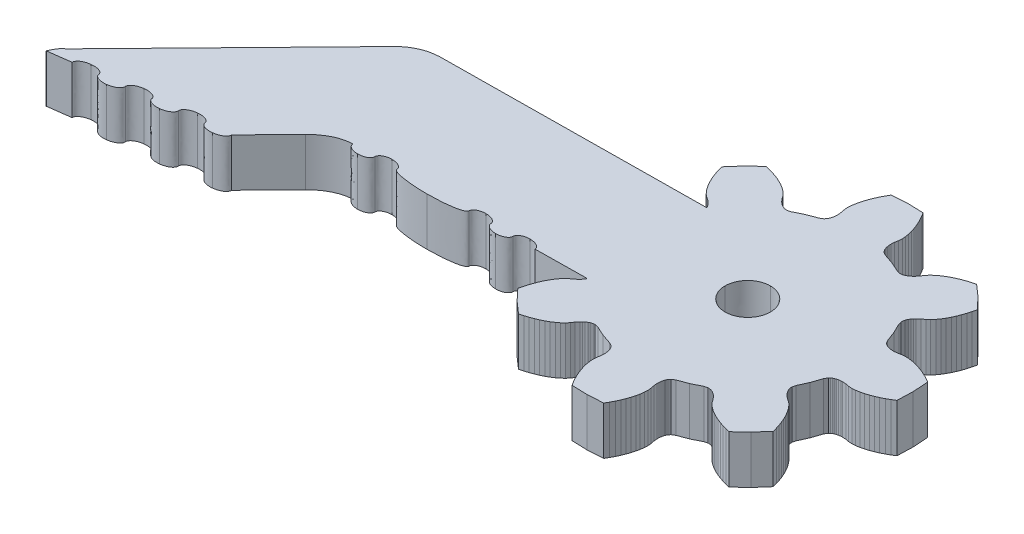
from build123d import *

# Parameters (mm, degrees)
BOSS_EXTRUDE1_DEPTH = 3.175


with BuildPart() as part:
    # Sketch1 → Boss-Extrude1 (new body)
    with BuildSketch(Plane(origin=(0, 0, 0), x_dir=(1, 0, 0), z_dir=(0, 1, 0))):
        with BuildLine():
            Line((81.057760584, 158.271437226), (81.024260584, 158.305437226))
            Line((81.024260584, 158.305437226), (77.647660584, 158.261337226))
            add(Edge.make_bspline(
                [(77.647660584, 158.261337226), (77.644460584, 158.489437226), (77.315160584, 158.674337226), (76.912260584, 158.674337226)],
                knots=[0.005763689, 0.005763689, 0.005763689, 0.005763689, 0.008645533, 0.008645533, 0.008645533, 0.008645533], degree=3))
            add(Edge.make_bspline(
                [(76.912260584, 158.674337226), (76.509260584, 158.674337226), (76.185260584, 158.489437226), (76.188460584, 158.261337226)],
                knots=[0.008645533, 0.008645533, 0.008645533, 0.008645533, 0.011527378, 0.011527378, 0.011527378, 0.011527378], degree=3))
            add(Edge.make_bspline(
                [(76.188460584, 158.261337226), (76.191560584, 158.033237226), (75.867560584, 157.848337226), (75.464560584, 157.848337226)],
                knots=[0.011527378, 0.011527378, 0.011527378, 0.011527378, 0.014409222, 0.014409222, 0.014409222, 0.014409222], degree=3))
            add(Edge.make_bspline(
                [(75.464560584, 157.848337226), (75.061660584, 157.848337226), (74.732360584, 158.033237226), (74.729160584, 158.261337226)],
                knots=[0.014409222, 0.014409222, 0.014409222, 0.014409222, 0.017291066, 0.017291066, 0.017291066, 0.017291066], degree=3))
            add(Edge.make_bspline(
                [(74.729160584, 158.261337226), (74.725860584, 158.489437226), (74.396660584, 158.674337226), (73.993660584, 158.674337226)],
                knots=[0.017291066, 0.017291066, 0.017291066, 0.017291066, 0.020172911, 0.020172911, 0.020172911, 0.020172911], degree=3))
            add(Edge.make_bspline(
                [(73.993660584, 158.674337226), (73.590760584, 158.674337226), (73.266660584, 158.489437226), (73.269660584, 158.261337226)],
                knots=[0.020172911, 0.020172911, 0.020172911, 0.020172911, 0.023054755, 0.023054755, 0.023054755, 0.023054755], degree=3))
            add(Edge.make_bspline(
                [(73.269660584, 158.261337226), (73.279960584, 158.033137226), (72.223060584, 157.848237226), (70.908960584, 157.848237226)],
                knots=[0.023054755, 0.023054755, 0.023054755, 0.023054755, 0.025936599, 0.025936599, 0.025936599, 0.025936599], degree=3))
            add(Edge.make_bspline(
                [(70.908960584, 157.848237226), (69.594860584, 157.848237226), (68.521060584, 158.033137226), (68.510660584, 158.261337226)],
                knots=[0.025936599, 0.025936599, 0.025936599, 0.025936599, 0.028818444, 0.028818444, 0.028818444, 0.028818444], degree=3))
            add(Edge.make_bspline(
                [(68.510660584, 158.261337226), (68.507360584, 158.489337226), (68.178160584, 158.674237226), (67.775160584, 158.674237226)],
                knots=[0.028818444, 0.028818444, 0.028818444, 0.028818444, 0.031700288, 0.031700288, 0.031700288, 0.031700288], degree=3))
            add(Edge.make_bspline(
                [(67.775160584, 158.674237226), (67.372260584, 158.674237226), (67.048160584, 158.489337226), (67.051360584, 158.261237226)],
                knots=[0.031700288, 0.031700288, 0.031700288, 0.031700288, 0.034582133, 0.034582133, 0.034582133, 0.034582133], degree=3))
            add(Edge.make_bspline(
                [(67.051360584, 158.261237226), (67.054560584, 158.033137226), (66.730460584, 157.848237226), (66.327560584, 157.848237226)],
                knots=[0.034582133, 0.034582133, 0.034582133, 0.034582133, 0.037463977, 0.037463977, 0.037463977, 0.037463977], degree=3))
            add(Edge.make_bspline(
                [(66.327560584, 157.848237226), (65.924560584, 157.848237226), (65.595360584, 158.033137226), (65.592160584, 158.261237226)],
                knots=[0.037463977, 0.037463977, 0.037463977, 0.037463977, 0.040345821, 0.040345821, 0.040345821, 0.040345821], degree=3))
            add(Edge.make_bspline(
                [(65.592160584, 158.261237226), (64.796560584, 158.251337226), (64.037360584, 157.811837226), (63.481760584, 157.242337226)],
                knots=[0.040345821, 0.040345821, 0.040345821, 0.040345821, 0.043227666, 0.043227666, 0.043227666, 0.043227666], degree=3))
            Line((63.481760584, 157.242337226), (61.063960584, 154.763437226))
            add(Edge.make_bspline(
                [(61.063960584, 154.763437226), (61.087160584, 154.536437226), (60.753960584, 154.311137226), (60.319760584, 154.259937226)],
                knots=[0.04610951, 0.04610951, 0.04610951, 0.04610951, 0.048991354, 0.048991354, 0.048991354, 0.048991354], degree=3))
            add(Edge.make_bspline(
                [(60.319760584, 154.259937226), (59.885460584, 154.208837226), (59.514660584, 154.351437226), (59.491460584, 154.578337226)],
                knots=[0.048991354, 0.048991354, 0.048991354, 0.048991354, 0.051873199, 0.051873199, 0.051873199, 0.051873199], degree=3))
            add(Edge.make_bspline(
                [(59.491460584, 154.578337226), (59.468160584, 154.805337226), (59.097360584, 154.947837226), (58.663160584, 154.896737226)],
                knots=[0.051873199, 0.051873199, 0.051873199, 0.051873199, 0.054755043, 0.054755043, 0.054755043, 0.054755043], degree=3))
            add(Edge.make_bspline(
                [(58.663160584, 154.896737226), (58.228860584, 154.845637226), (57.895660584, 154.620237226), (57.918860584, 154.393337226)],
                knots=[0.054755043, 0.054755043, 0.054755043, 0.054755043, 0.057636888, 0.057636888, 0.057636888, 0.057636888], degree=3))
            add(Edge.make_bspline(
                [(57.918860584, 154.393337226), (57.942060584, 154.166437226), (57.608860584, 153.941037226), (57.174560584, 153.889937226)],
                knots=[0.057636888, 0.057636888, 0.057636888, 0.057636888, 0.060518732, 0.060518732, 0.060518732, 0.060518732], degree=3))
            add(Edge.make_bspline(
                [(57.174560584, 153.889937226), (56.740360584, 153.838837226), (56.369460584, 153.981337226), (56.346260584, 154.208337226)],
                knots=[0.060518732, 0.060518732, 0.060518732, 0.060518732, 0.063400576, 0.063400576, 0.063400576, 0.063400576], degree=3))
            add(Edge.make_bspline(
                [(56.346260584, 154.208337226), (56.323060584, 154.435237226), (55.952160584, 154.577737226), (55.517960584, 154.526637226)],
                knots=[0.063400576, 0.063400576, 0.063400576, 0.063400576, 0.066282421, 0.066282421, 0.066282421, 0.066282421], degree=3))
            add(Edge.make_bspline(
                [(55.517960584, 154.526637226), (55.083660584, 154.475537226), (54.750460584, 154.250137226), (54.773760584, 154.023237226)],
                knots=[0.066282421, 0.066282421, 0.066282421, 0.066282421, 0.069164265, 0.069164265, 0.069164265, 0.069164265], degree=3))
            add(Edge.make_bspline(
                [(54.773760584, 154.023237226), (54.796860584, 153.796337226), (54.463660584, 153.570937226), (54.029360584, 153.519837226)],
                knots=[0.069164265, 0.069164265, 0.069164265, 0.069164265, 0.07204611, 0.07204611, 0.07204611, 0.07204611], degree=3))
            add(Edge.make_bspline(
                [(54.029360584, 153.519837226), (53.595160584, 153.468737226), (53.224360584, 153.611237226), (53.201160584, 153.838237226)],
                knots=[0.07204611, 0.07204611, 0.07204611, 0.07204611, 0.074927954, 0.074927954, 0.074927954, 0.074927954], degree=3))
            add(Edge.make_bspline(
                [(53.201160584, 153.838237226), (53.177860584, 154.065137226), (52.807060584, 154.207737226), (52.372760584, 154.156637226)],
                knots=[0.074927954, 0.074927954, 0.074927954, 0.074927954, 0.077809798, 0.077809798, 0.077809798, 0.077809798], degree=3))
            add(Edge.make_bspline(
                [(52.372760584, 154.156637226), (51.938560584, 154.105437226), (51.605360584, 153.880137226), (51.628560584, 153.653137226)],
                knots=[0.077809798, 0.077809798, 0.077809798, 0.077809798, 0.080691643, 0.080691643, 0.080691643, 0.080691643], degree=3))
            Line((51.628560584, 153.653137226), (50.124060584, 153.450637226))
            Line((50.124060584, 153.450637226), (50.127260584, 153.424837226))
            add(Edge.make_bspline(
                [(50.127260584, 153.424837226), (50.060160584, 153.424037226), (50.344260584, 153.959637226), (50.576860584, 154.198137226)],
                knots=[0.086455331, 0.086455331, 0.086455331, 0.086455331, 0.089337176, 0.089337176, 0.089337176, 0.089337176], degree=3))
            Line((50.576860584, 154.198137226), (50.620060584, 154.182837226))
            Line((50.620060584, 154.182837226), (61.382160584, 165.216737226))
            Line((61.382160584, 165.216737226), (61.385660584, 165.218237226))
            add(Edge.make_bspline(
                [(61.385660584, 165.218237226), (61.937960584, 165.791037226), (62.695160584, 166.120937226), (63.490660584, 166.135437226)],
                knots=[0.097982709, 0.097982709, 0.097982709, 0.097982709, 0.100864553, 0.100864553, 0.100864553, 0.100864553], degree=3))
            Line((63.490660584, 166.135437226), (80.976260584, 166.317737226))
            Line((80.976260584, 166.317737226), (80.961760584, 166.327237226))
            Line((80.961760584, 166.327237226), (80.930260584, 166.385737226))
            Line((80.930260584, 166.385737226), (80.860460584, 166.490737226))
            Line((80.860460584, 166.490737226), (80.783760584, 166.583937226))
            Line((80.783760584, 166.583937226), (80.701660584, 166.668037226))
            Line((80.701660584, 166.668037226), (80.524560584, 166.814937226))
            Line((80.524560584, 166.814937226), (80.333360584, 166.939237226))
            Line((80.333360584, 166.939237226), (80.155660584, 167.084937226))
            Line((80.155660584, 167.084937226), (79.996660584, 167.259937226))
            Line((79.996660584, 167.259937226), (79.850060584, 167.453237226))
            Line((79.850060584, 167.453237226), (79.714460584, 167.661737226))
            Line((79.714460584, 167.661737226), (79.589360584, 167.883737226))
            Line((79.589360584, 167.883737226), (79.474460584, 168.117937226))
            Line((79.474460584, 168.117937226), (79.369860584, 168.363537226))
            Line((79.369860584, 168.363537226), (79.275360584, 168.619737226))
            Line((79.275360584, 168.619737226), (79.191460584, 168.886037226))
            Line((79.191460584, 168.886037226), (79.118060584, 169.161737226))
            Line((79.118060584, 169.161737226), (79.800860584, 169.937437226))
            Line((79.800860584, 169.937437226), (80.554760584, 170.644337226))
            Line((80.554760584, 170.644337226), (80.832660584, 170.579637226))
            Line((80.832660584, 170.579637226), (81.101360584, 170.504037226))
            Line((81.101360584, 170.504037226), (81.360460584, 170.417737226))
            Line((81.360460584, 170.417737226), (81.609260584, 170.320837226))
            Line((81.609260584, 170.320837226), (81.846960584, 170.213337226))
            Line((81.846960584, 170.213337226), (82.072760584, 170.095237226))
            Line((82.072760584, 170.095237226), (82.285360584, 169.966337226))
            Line((82.285360584, 169.966337226), (82.483160584, 169.825937226))
            Line((82.483160584, 169.825937226), (82.663060584, 169.672437226))
            Line((82.663060584, 169.672437226), (82.814360584, 169.499437226))
            Line((82.814360584, 169.499437226), (82.944560584, 169.312237226))
            Line((82.944560584, 169.312237226), (83.096960584, 169.139837226))
            Line((83.096960584, 169.139837226), (83.183560584, 169.060337226))
            Line((83.183560584, 169.060337226), (83.279160584, 168.986637226))
            Line((83.279160584, 168.986637226), (83.386360584, 168.920137226))
            Line((83.386360584, 168.920137226), (83.445760584, 168.890537226))
            Line((83.445760584, 168.890537226), (83.510460584, 168.863937226))
            Line((83.510460584, 168.863937226), (83.582360584, 168.841537226))
            Line((83.582360584, 168.841537226), (83.665060584, 168.825337226))
            Line((83.665060584, 168.825337226), (83.767960584, 168.820537226))
            Line((83.767960584, 168.820537226), (83.987560584, 168.880437226))
            Line((83.987560584, 168.880437226), (84.621160584, 169.191437226))
            Line((84.621160584, 169.191437226), (85.281460584, 169.440337226))
            Line((85.281460584, 169.440337226), (85.475560584, 169.559537226))
            Line((85.475560584, 169.559537226), (85.542460584, 169.637837226))
            Line((85.542460584, 169.637837226), (85.587260584, 169.709137226))
            Line((85.587260584, 169.709137226), (85.620160584, 169.776837226))
            Line((85.620160584, 169.776837226), (85.645060584, 169.842237226))
            Line((85.645060584, 169.842237226), (85.664060584, 169.905837226))
            Line((85.664060584, 169.905837226), (85.689060584, 170.029537226))
            Line((85.689060584, 170.029537226), (85.700660584, 170.149637226))
            Line((85.700660584, 170.149637226), (85.702160584, 170.267137226))
            Line((85.702160584, 170.267137226), (85.680760584, 170.496237226))
            Line((85.680760584, 170.496237226), (85.633360584, 170.719337226))
            Line((85.633360584, 170.719337226), (85.610860584, 170.948037226))
            Line((85.610860584, 170.948037226), (85.622160584, 171.184237226))
            Line((85.622160584, 171.184237226), (85.655160584, 171.424537226))
            Line((85.655160584, 171.424537226), (85.706760584, 171.667837226))
            Line((85.706760584, 171.667837226), (85.775160584, 171.913237226))
            Line((85.775160584, 171.913237226), (85.859560584, 172.160137226))
            Line((85.859560584, 172.160137226), (85.959260584, 172.407837226))
            Line((85.959260584, 172.407837226), (86.073660584, 172.655737226))
            Line((86.073660584, 172.655737226), (86.202560584, 172.903437226))
            Line((86.202560584, 172.903437226), (86.345660584, 173.150237226))
            Line((86.345660584, 173.150237226), (87.376960584, 173.215937226))
            Line((87.376960584, 173.215937226), (88.409860584, 173.182637226))
            Line((88.409860584, 173.182637226), (88.560660584, 172.940437226))
            Line((88.560660584, 172.940437226), (88.697260584, 172.696937226))
            Line((88.697260584, 172.696937226), (88.819460584, 172.452737226))
            Line((88.819460584, 172.452737226), (88.926760584, 172.208237226))
            Line((88.926760584, 172.208237226), (89.018860584, 171.964237226))
            Line((89.018860584, 171.964237226), (89.095060584, 171.721037226))
            Line((89.095060584, 171.721037226), (89.154260584, 171.479537226))
            Line((89.154260584, 171.479537226), (89.194760584, 171.240337226))
            Line((89.194760584, 171.240337226), (89.213560584, 171.004637226))
            Line((89.213560584, 171.004637226), (89.198060584, 170.775337226))
            Line((89.198060584, 170.775337226), (89.157860584, 170.550837226))
            Line((89.157860584, 170.550837226), (89.143660584, 170.321237226))
            Line((89.143660584, 170.321237226), (89.148760584, 170.203837226))
            Line((89.148760584, 170.203837226), (89.164160584, 170.084137226))
            Line((89.164160584, 170.084137226), (89.192960584, 169.961337226))
            Line((89.192960584, 169.961337226), (89.213960584, 169.898237226))
            Line((89.213960584, 169.898237226), (89.240960584, 169.833737226))
            Line((89.240960584, 169.833737226), (89.275960584, 169.767137226))
            Line((89.275960584, 169.767137226), (89.323060584, 169.697137226))
            Line((89.323060584, 169.697137226), (89.392360584, 169.621037226))
            Line((89.392360584, 169.621037226), (89.589960584, 169.508037226))
            Line((89.589960584, 169.508037226), (90.257860584, 169.280037226))
            Line((90.257860584, 169.280037226), (90.900860584, 168.989037226))
            Line((90.900860584, 168.989037226), (91.122260584, 168.936137226))
            Line((91.122260584, 168.936137226), (91.224960584, 168.944137226))
            Line((91.224960584, 168.944137226), (91.307160584, 168.962937226))
            Line((91.307160584, 168.962937226), (91.378260584, 168.987537226))
            Line((91.378260584, 168.987537226), (91.442160584, 169.016137226))
            Line((91.442160584, 169.016137226), (91.500560584, 169.047637226))
            Line((91.500560584, 169.047637226), (91.605660584, 169.117437226))
            Line((91.605660584, 169.117437226), (91.698860584, 169.194137226))
            Line((91.698860584, 169.194137226), (91.782860584, 169.276237226))
            Line((91.782860584, 169.276237226), (91.929760584, 169.453337226))
            Line((91.929760584, 169.453337226), (92.054060584, 169.644537226))
            Line((92.054060584, 169.644537226), (92.199860584, 169.822337226))
            Line((92.199860584, 169.822337226), (92.374860584, 169.981237226))
            Line((92.374860584, 169.981237226), (92.568160584, 170.127837226))
            Line((92.568160584, 170.127837226), (92.776660584, 170.263437226))
            Line((92.776660584, 170.263437226), (92.998560584, 170.388537226))
            Line((92.998560584, 170.388537226), (93.232760584, 170.503437226))
            Line((93.232760584, 170.503437226), (93.478360584, 170.608137226))
            Line((93.478360584, 170.608137226), (93.734660584, 170.702537226))
            Line((93.734660584, 170.702537226), (94.000960584, 170.786437226))
            Line((94.000960584, 170.786437226), (94.276560584, 170.859837226))
            Line((94.276560584, 170.859837226), (95.052360584, 170.177037226))
            Line((95.052360584, 170.177037226), (95.759160584, 169.423137226))
            Line((95.759160584, 169.423137226), (95.694460584, 169.145337226))
            Line((95.694460584, 169.145337226), (95.618860584, 168.876537226))
            Line((95.618860584, 168.876537226), (95.532660584, 168.617437226))
            Line((95.532660584, 168.617437226), (95.435660584, 168.368637226))
            Line((95.435660584, 168.368637226), (95.328260584, 168.130937226))
            Line((95.328260584, 168.130937226), (95.210160584, 167.905137226))
            Line((95.210160584, 167.905137226), (95.081160584, 167.692537226))
            Line((95.081160584, 167.692537226), (94.940760584, 167.494737226))
            Line((94.940760584, 167.494737226), (94.787360584, 167.314837226))
            Line((94.787360584, 167.314837226), (94.614360584, 167.163537226))
            Line((94.614360584, 167.163537226), (94.427060584, 167.033337226))
            Line((94.427060584, 167.033337226), (94.254660584, 166.880937226))
            Line((94.254660584, 166.880937226), (94.175260584, 166.794337226))
            Line((94.175260584, 166.794337226), (94.101560584, 166.698837226))
            Line((94.101560584, 166.698837226), (94.035060584, 166.591537226))
            Line((94.035060584, 166.591537226), (94.005360584, 166.532137226))
            Line((94.005360584, 166.532137226), (93.978760584, 166.467437226))
            Line((93.978760584, 166.467437226), (93.956460584, 166.395537226))
            Line((93.956460584, 166.395537226), (93.940260584, 166.312837226))
            Line((93.940260584, 166.312837226), (93.935460584, 166.210037226))
            Line((93.935460584, 166.210037226), (93.995360584, 165.990337226))
            Line((93.995360584, 165.990337226), (94.306360584, 165.356837226))
            Line((94.306360584, 165.356837226), (94.555260584, 164.696437226))
            Line((94.555260584, 164.696437226), (94.674360584, 164.502437226))
            Line((94.674360584, 164.502437226), (94.752660584, 164.435437226))
            Line((94.752660584, 164.435437226), (94.823960584, 164.390637226))
            Line((94.823960584, 164.390637226), (94.891760584, 164.357837226))
            Line((94.891760584, 164.357837226), (94.957060584, 164.332837226))
            Line((94.957060584, 164.332837226), (95.020760584, 164.313837226))
            Line((95.020760584, 164.313837226), (95.144360584, 164.288837226))
            Line((95.144360584, 164.288837226), (95.264460584, 164.277237226))
            Line((95.264460584, 164.277237226), (95.381960584, 164.275837226))
            Line((95.381960584, 164.275837226), (95.611160584, 164.297237226))
            Line((95.611160584, 164.297237226), (95.834160584, 164.344537226))
            Line((95.834160584, 164.344537226), (96.062960584, 164.367137226))
            Line((96.062960584, 164.367137226), (96.299160584, 164.355737226))
            Line((96.299160584, 164.355737226), (96.539460584, 164.322737226))
            Line((96.539460584, 164.322737226), (96.782760584, 164.271237226))
            Line((96.782760584, 164.271237226), (97.028160584, 164.202737226))
            Line((97.028160584, 164.202737226), (97.274960584, 164.118337226))
            Line((97.274960584, 164.118337226), (97.522660584, 164.018637226))
            Line((97.522660584, 164.018637226), (97.770660584, 163.904237226))
            Line((97.770660584, 163.904237226), (98.018260584, 163.775337226))
            Line((98.018260584, 163.775337226), (98.265160584, 163.632337226))
            Line((98.265160584, 163.632337226), (98.330760584, 162.600937226))
            Line((98.330760584, 162.600937226), (98.297560584, 161.568037226))
            Line((98.297560584, 161.568037226), (98.055360584, 161.417337226))
            Line((98.055360584, 161.417337226), (97.811860584, 161.280637226))
            Line((97.811860584, 161.280637226), (97.567660584, 161.158537226))
            Line((97.567660584, 161.158537226), (97.323160584, 161.051137226))
            Line((97.323160584, 161.051137226), (97.079060584, 160.959037226))
            Line((97.079060584, 160.959037226), (96.835960584, 160.882937226))
            Line((96.835960584, 160.882937226), (96.594360584, 160.823737226))
            Line((96.594360584, 160.823737226), (96.355260584, 160.783137226))
            Line((96.355260584, 160.783137226), (96.119560584, 160.764437226))
            Line((96.119560584, 160.764437226), (95.890260584, 160.779837226))
            Line((95.890260584, 160.779837226), (95.665760584, 160.820137226))
            Line((95.665760584, 160.820137226), (95.436060584, 160.834237226))
            Line((95.436060584, 160.834237226), (95.318660584, 160.829137226))
            Line((95.318660584, 160.829137226), (95.198960584, 160.813737226))
            Line((95.198960584, 160.813737226), (95.076160584, 160.784937226))
            Line((95.076160584, 160.784937226), (95.013160584, 160.763937226))
            Line((95.013160584, 160.763937226), (94.948660584, 160.736937226))
            Line((94.948660584, 160.736937226), (94.881960584, 160.701937226))
            Line((94.881960584, 160.701937226), (94.812060584, 160.654937226))
            Line((94.812060584, 160.654937226), (94.735960584, 160.585537226))
            Line((94.735960584, 160.585537226), (94.622960584, 160.387937226))
            Line((94.622960584, 160.387937226), (94.394860584, 159.720037226))
            Line((94.394860584, 159.720037226), (94.103860584, 159.077037226))
            Line((94.103860584, 159.077037226), (94.050960584, 158.855637226))
            Line((94.050960584, 158.855637226), (94.059060584, 158.752937226))
            Line((94.059060584, 158.752937226), (94.077760584, 158.670837226))
            Line((94.077760584, 158.670837226), (94.102460584, 158.599637226))
            Line((94.102460584, 158.599637226), (94.130960584, 158.535837226))
            Line((94.130960584, 158.535837226), (94.162560584, 158.477337226))
            Line((94.162560584, 158.477337226), (94.232360584, 158.372237226))
            Line((94.232360584, 158.372237226), (94.309060584, 158.279137226))
            Line((94.309060584, 158.279137226), (94.391160584, 158.195037226))
            Line((94.391160584, 158.195037226), (94.568260584, 158.048137226))
            Line((94.568260584, 158.048137226), (94.759460584, 157.923837226))
            Line((94.759460584, 157.923837226), (94.937160584, 157.778037226))
            Line((94.937160584, 157.778037226), (95.096160584, 157.603037226))
            Line((95.096160584, 157.603037226), (95.242660584, 157.409737226))
            Line((95.242660584, 157.409737226), (95.378260584, 157.201337226))
            Line((95.378260584, 157.201337226), (95.503460584, 156.979337226))
            Line((95.503460584, 156.979337226), (95.618360584, 156.745137226))
            Line((95.618360584, 156.745137226), (95.722960584, 156.499537226))
            Line((95.722960584, 156.499537226), (95.817360584, 156.243237226))
            Line((95.817360584, 156.243237226), (95.901360584, 155.976937226))
            Line((95.901360584, 155.976937226), (95.974760584, 155.701337226))
            Line((95.974760584, 155.701337226), (95.291960584, 154.925537226))
            Line((95.291960584, 154.925537226), (94.538060584, 154.218737226))
            Line((94.538060584, 154.218737226), (94.260160584, 154.283437226))
            Line((94.260160584, 154.283437226), (93.991360584, 154.359037226))
            Line((93.991360584, 154.359037226), (93.732360584, 154.445337226))
            Line((93.732360584, 154.445337226), (93.483560584, 154.542237226))
            Line((93.483560584, 154.542237226), (93.245760584, 154.649637226))
            Line((93.245760584, 154.649637226), (93.020060584, 154.767737226))
            Line((93.020060584, 154.767737226), (92.807360584, 154.896737226))
            Line((92.807360584, 154.896737226), (92.609660584, 155.037137226))
            Line((92.609660584, 155.037137226), (92.429660584, 155.190537226))
            Line((92.429660584, 155.190537226), (92.278460584, 155.363637226))
            Line((92.278460584, 155.363637226), (92.148160584, 155.550837226))
            Line((92.148160584, 155.550837226), (91.995860584, 155.723237226))
            Line((91.995860584, 155.723237226), (91.909160584, 155.802637226))
            Line((91.909160584, 155.802637226), (91.813660584, 155.876337226))
            Line((91.813660584, 155.876337226), (91.706460584, 155.942837226))
            Line((91.706460584, 155.942837226), (91.647060584, 155.972537226))
            Line((91.647060584, 155.972537226), (91.582360584, 155.999137226))
            Line((91.582360584, 155.999137226), (91.510460584, 156.021537226))
            Line((91.510460584, 156.021537226), (91.427760584, 156.037637226))
            Line((91.427760584, 156.037637226), (91.324860584, 156.042437226))
            Line((91.324860584, 156.042437226), (91.105160584, 155.982637226))
            Line((91.105160584, 155.982637226), (90.471660584, 155.671637226))
            Line((90.471660584, 155.671637226), (89.811260584, 155.422637226))
            Line((89.811260584, 155.422637226), (89.617260584, 155.303537226))
            Line((89.617260584, 155.303537226), (89.550360584, 155.225237226))
            Line((89.550360584, 155.225237226), (89.505560584, 155.153937226))
            Line((89.505560584, 155.153937226), (89.472660584, 155.086237226))
            Line((89.472660584, 155.086237226), (89.447760584, 155.020837226))
            Line((89.447760584, 155.020837226), (89.428660584, 154.957137226))
            Line((89.428660584, 154.957137226), (89.403760584, 154.833537226))
            Line((89.403760584, 154.833537226), (89.392060584, 154.713437226))
            Line((89.392060584, 154.713437226), (89.390660584, 154.595937226))
            Line((89.390660584, 154.595937226), (89.412060584, 154.366737226))
            Line((89.412060584, 154.366737226), (89.459360584, 154.143737226))
            Line((89.459360584, 154.143737226), (89.481960584, 153.914937226))
            Line((89.481960584, 153.914937226), (89.470660584, 153.678837226))
            Line((89.470660584, 153.678837226), (89.437660584, 153.438537226))
            Line((89.437660584, 153.438537226), (89.386060584, 153.195237226))
            Line((89.386060584, 153.195237226), (89.317560584, 152.949737226))
            Line((89.317560584, 152.949737226), (89.233160584, 152.702937226))
            Line((89.233160584, 152.702937226), (89.133560584, 152.455237226))
            Line((89.133560584, 152.455237226), (89.019060584, 152.207237226))
            Line((89.019060584, 152.207237226), (88.890260584, 151.959637226))
            Line((88.890260584, 151.959637226), (88.747160584, 151.712837226))
            Line((88.747160584, 151.712837226), (87.715860584, 151.647137226))
            Line((87.715860584, 151.647137226), (86.682860584, 151.680437226))
            Line((86.682860584, 151.680437226), (86.532160584, 151.922637226))
            Line((86.532160584, 151.922637226), (86.395560584, 152.166037226))
            Line((86.395560584, 152.166037226), (86.273360584, 152.410337226))
            Line((86.273360584, 152.410337226), (86.165960584, 152.654737226))
            Line((86.165960584, 152.654737226), (86.073860584, 152.898837226))
            Line((86.073860584, 152.898837226), (85.997760584, 153.141937226))
            Line((85.997760584, 153.141937226), (85.938560584, 153.383537226))
            Line((85.938560584, 153.383537226), (85.898060584, 153.622637226))
            Line((85.898060584, 153.622637226), (85.879260584, 153.858437226))
            Line((85.879260584, 153.858437226), (85.894660584, 154.087737226))
            Line((85.894660584, 154.087737226), (85.934960584, 154.312137226))
            Line((85.934960584, 154.312137226), (85.949160584, 154.541837226))
            Line((85.949160584, 154.541837226), (85.944060584, 154.659237226))
            Line((85.944060584, 154.659237226), (85.928660584, 154.778937226))
            Line((85.928660584, 154.778937226), (85.899860584, 154.901737226))
            Line((85.899860584, 154.901737226), (85.878760584, 154.964737226))
            Line((85.878760584, 154.964737226), (85.851760584, 155.029337226))
            Line((85.851760584, 155.029337226), (85.816760584, 155.095937226))
            Line((85.816760584, 155.095937226), (85.769760584, 155.165837226))
            Line((85.769760584, 155.165837226), (85.700460584, 155.242037226))
            Line((85.700460584, 155.242037226), (85.502760584, 155.354937226))
            Line((85.502760584, 155.354937226), (84.834860584, 155.583037226))
            Line((84.834860584, 155.583037226), (84.191860584, 155.874037226))
            Line((84.191860584, 155.874037226), (83.970460584, 155.926937226))
            Line((83.970460584, 155.926937226), (83.867860584, 155.918937226))
            Line((83.867860584, 155.918937226), (83.785660584, 155.900137226))
            Line((83.785660584, 155.900137226), (83.714560584, 155.875537226))
            Line((83.714560584, 155.875537226), (83.650660584, 155.846937226))
            Line((83.650660584, 155.846937226), (83.592160584, 155.815337226))
            Line((83.592160584, 155.815337226), (83.487160584, 155.745637226))
            Line((83.487160584, 155.745637226), (83.393960584, 155.668937226))
            Line((83.393960584, 155.668937226), (83.309860584, 155.586837226))
            Line((83.309860584, 155.586837226), (83.162960584, 155.409637226))
            Line((83.162960584, 155.409637226), (83.038760584, 155.218437226))
            Line((83.038760584, 155.218437226), (82.892960584, 155.040737226))
            Line((82.892960584, 155.040737226), (82.717960584, 154.881737226))
            Line((82.717960584, 154.881737226), (82.524660584, 154.735237226))
            Line((82.524660584, 154.735237226), (82.316160584, 154.599637226))
            Line((82.316160584, 154.599637226), (82.094260584, 154.474537226))
            Line((82.094260584, 154.474537226), (81.859960584, 154.359637226))
            Line((81.859960584, 154.359637226), (81.614360584, 154.254937226))
            Line((81.614360584, 154.254937226), (81.358160584, 154.160537226))
            Line((81.358160584, 154.160537226), (81.091860584, 154.076537226))
            Line((81.091860584, 154.076537226), (80.816160584, 154.003137226))
            Line((80.816160584, 154.003137226), (80.040460584, 154.686037226))
            Line((80.040460584, 154.686037226), (79.333560584, 155.439937226))
            Line((79.333560584, 155.439937226), (79.398260584, 155.717737226))
            Line((79.398260584, 155.717737226), (79.473860584, 155.986537226))
            Line((79.473860584, 155.986537226), (79.560160584, 156.245637226))
            Line((79.560160584, 156.245637226), (79.657060584, 156.494337226))
            Line((79.657060584, 156.494337226), (79.764560584, 156.732137226))
            Line((79.764560584, 156.732137226), (79.882660584, 156.957837226))
            Line((79.882660584, 156.957837226), (80.011560584, 157.170537226))
            Line((80.011560584, 157.170537226), (80.152060584, 157.368237226))
            Line((80.152060584, 157.368237226), (80.305460584, 157.548237226))
            Line((80.305460584, 157.548237226), (80.478460584, 157.699537226))
            Line((80.478460584, 157.699537226), (80.665660584, 157.829737226))
            Line((80.665660584, 157.829737226), (80.838160584, 157.982137226))
            Line((80.838160584, 157.982137226), (80.917560584, 158.068737226))
            Line((80.917560584, 158.068737226), (80.991260584, 158.164237226))
            Line((80.991260584, 158.164237226), (81.057760584, 158.271437226))
        make_face()
        with BuildLine():
            add(Edge.make_bspline(
                [(86.046260584, 162.444137226), (86.046260584, 161.615737226), (86.717860584, 160.944037226), (87.546260584, 160.944037226)],
                knots=[0, 0, 0, 0, 0.2, 0.2, 0.2, 0.2], degree=3))
            add(Edge.make_bspline(
                [(87.546260584, 160.944037226), (88.374660584, 160.943937226), (89.046360584, 161.615737226), (89.046360584, 162.444037226)],
                knots=[0.2, 0.2, 0.2, 0.2, 0.4, 0.4, 0.4, 0.4], degree=3))
            add(Edge.make_bspline(
                [(89.046360584, 162.444037226), (89.046460584, 163.272537226), (88.374660584, 163.944137226), (87.546360584, 163.944237226)],
                knots=[0.4, 0.4, 0.4, 0.4, 0.6, 0.6, 0.6, 0.6], degree=3))
            add(Edge.make_bspline(
                [(87.546360584, 163.944237226), (86.717860584, 163.944237226), (86.046260584, 163.272537226), (86.046260584, 162.444137226)],
                knots=[0.6, 0.6, 0.6, 0.6, 1, 1, 1, 1], degree=3))
        make_face(mode=Mode.SUBTRACT)
    extrude(amount=BOSS_EXTRUDE1_DEPTH)


solid = part.part
